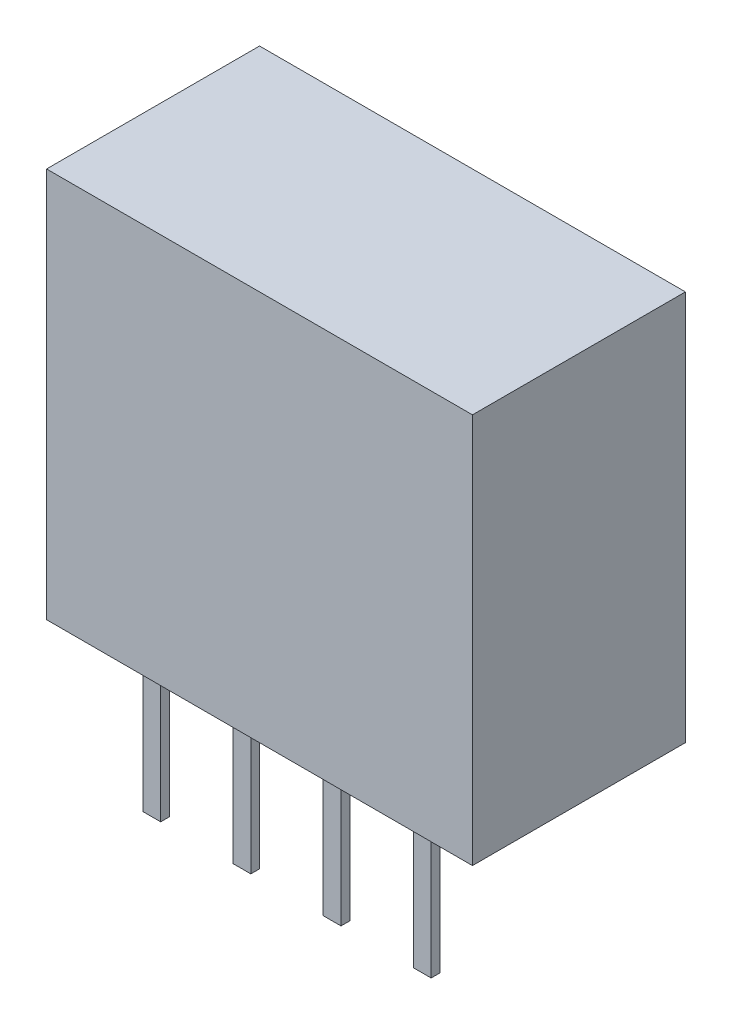
from build123d import *

# Parameters (mm, degrees)
SKETCH1_W           = 12
SKETCH1_H           = 11
BOSS_EXTRUDE1_DEPTH = 6
SKETCH2_W           = 0.5
SKETCH2_H           = 0.25
BOSS_EXTRUDE2_DEPTH = 4.1


with BuildPart() as part:
    # Sketch1 → Boss-Extrude1 (new body)
    with BuildSketch(Plane.XY):
        Rectangle(SKETCH1_W, SKETCH1_H)
    extrude(amount=BOSS_EXTRUDE1_DEPTH)

    # Sketch2 → Boss-Extrude2 (add)
    with BuildSketch(Plane.XZ.offset(5.5)):
        with Locations((1.27, 5.1)):
            Rectangle(SKETCH2_W, SKETCH2_H)
        with Locations((3.81, 5.1)):
            Rectangle(SKETCH2_W, SKETCH2_H)
        with Locations((-1.27, 5.1)):
            Rectangle(SKETCH2_W, SKETCH2_H)
        with Locations((-3.81, 5.1)):
            Rectangle(SKETCH2_W, SKETCH2_H)
    extrude(amount=BOSS_EXTRUDE2_DEPTH)


solid = part.part
